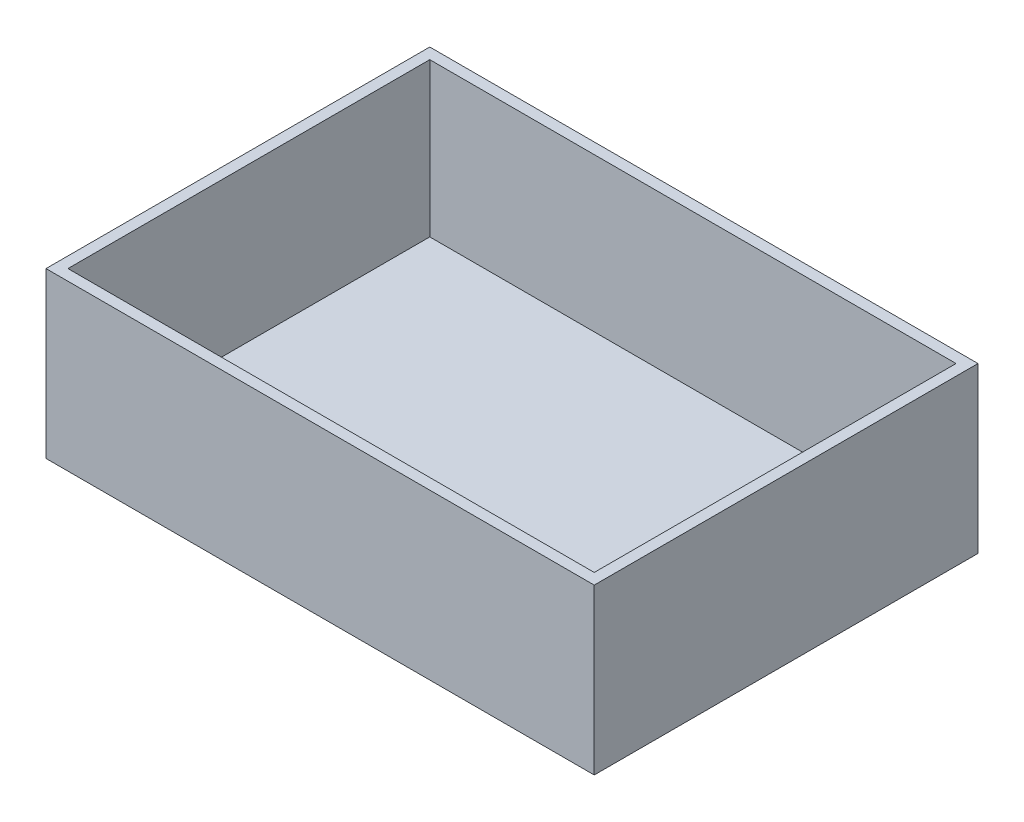
from build123d import *

# Parameters (mm, degrees)
CROQUIS1_W              = 100
CROQUIS1_H              = 70
SALIENTE_EXTRUIR1_DEPTH = 30
VACIADO1_T              = -2


with BuildPart() as part:
    # Croquis1 → Saliente-Extruir1 (new body)
    with BuildSketch(Plane(origin=(0, 0, 0), x_dir=(1, 0, 0), z_dir=(0, 1, 0))):
        Rectangle(CROQUIS1_W, CROQUIS1_H)
    extrude(amount=SALIENTE_EXTRUIR1_DEPTH)

    # Vaciado1
    vaciado1_openings = [part.faces().sort_by_distance(p)[0] for p in [
        (0, 30, 0),
    ]]
    offset(amount=VACIADO1_T, openings=vaciado1_openings, kind=Kind.INTERSECTION)


solid = part.part
